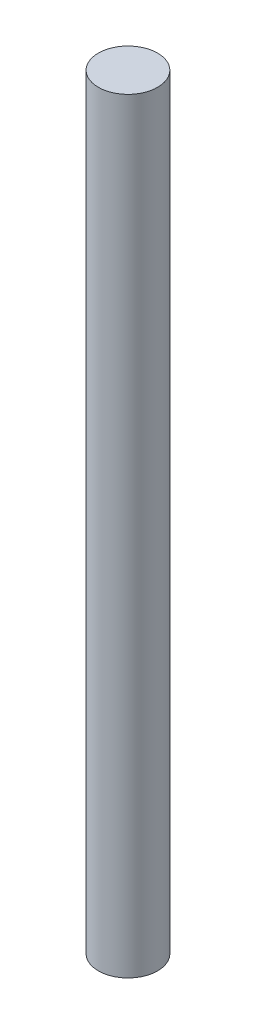
from build123d import *

# Parameters (mm, degrees)
ESBO_O1_R                = 6
RESSALTO_EXTRUS_O1_DEPTH = 155


with BuildPart() as part:
    # Esboço1 → Ressalto-extrusão1 (new body)
    with BuildSketch(Plane(origin=(0, 0, 0), x_dir=(1, 0, 0), z_dir=(0, 1, 0))):
        with Locations(Location((0, 0, 0), (0, 0, 270))):
            Circle(ESBO_O1_R)
    extrude(amount=RESSALTO_EXTRUS_O1_DEPTH)


solid = part.part
